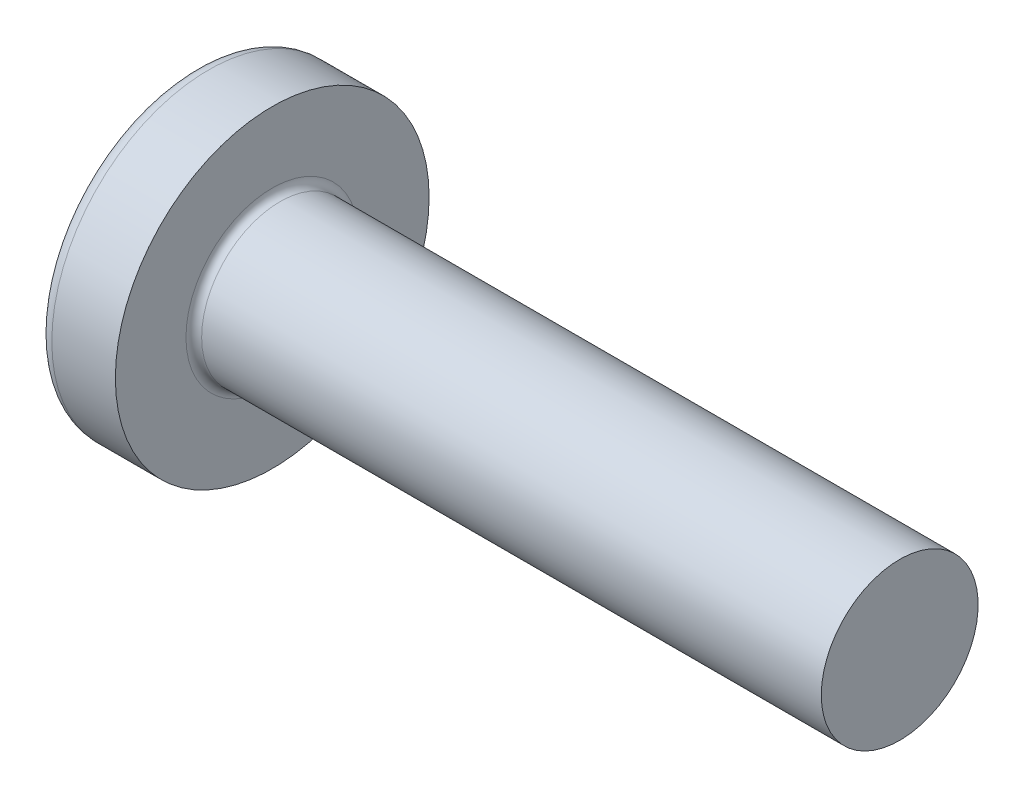
from build123d import *

# Parameters (mm, degrees)
FILLET1_R    = 0.1
RECPAT_COUNT = 2
RECPAT_ANGLE = 90


with BuildPart() as part:
    # BodySke → Base-Revolve (revolve)
    with BuildSketch(Plane.XY, mode=Mode.PRIVATE) as base_revolve_sk:
        with BuildLine():
            Line((1.6, 1), (1.6, 2))
            Line((1.6, 2), (0.790020747, 2))
            ThreePointArc((0.790020747, 2), (0.709789294, 1.981130115), (0.646379599, 1.928476821))
            ThreePointArc((0.646379599, 1.928476821), (0.165895084, 1.016959861), (0, 0))
            Line((0, 0), (9.6, 0))
            Line((9.6, 0), (9.6, 1))
            Line((9.6, 1), (1.6, 1))
        make_face()
    revolve(base_revolve_sk.sketch.rotate(Axis((0.790020747, 0, 0), (1, 0, 0)), 90), axis=Axis((0.790020747, 0, 0), (1, 0, 0)))

    # Fillet1
    fillet1_edges = [part.edges().sort_by_distance(p)[0] for p in [
        (1.6, 0, -1),
    ]]
    fillet(fillet1_edges, radius=FILLET1_R)

    # Sketch3 → Recess section 0
    with BuildSketch(Plane(origin=(0, 0, 0), x_dir=(0, 0, -1), z_dir=(1, 0, 0))):
        with BuildLine():
            Line((0.24, -1.05), (-0.24, -1.05))
            Line((-0.24, -1.05), (-0.24, 1.05))
            Line((-0.24, 1.05), (0.24, 1.05))
            Line((0.24, 1.05), (0.24, -1.05))
        make_face()
    # Sketch4 → Recess section 1
    with BuildSketch(Plane(origin=(1.42, 0, 0), x_dir=(0, 0, -1), z_dir=(1, 0, 0))):
        with BuildLine():
            Line((0.24, -0.342014235), (-0.24, -0.342014235))
            Line((-0.24, -0.342014235), (-0.24, 0.342014235))
            Line((-0.24, 0.342014235), (0.24, 0.342014235))
            Line((0.24, 0.342014235), (0.24, -0.342014235))
        make_face()
    recess = loft(mode=Mode.SUBTRACT)

    # RecPat: Recess ×2 about axis
    recpat_axis = Axis((0, 0, 0), (1, 0, 0))
    for i in range(1, RECPAT_COUNT):
        add(recess.rotate(recpat_axis, i * RECPAT_ANGLE / (RECPAT_COUNT - 1)), mode=Mode.SUBTRACT)

    # RecCorSke → RecessCore (revolve, cut)
    with BuildSketch(Plane.XY, mode=Mode.PRIVATE) as recesscore_sk:
        Polygon((0, 0), (0, 0.454796073), (1.42, 0.3555), (1.535508952, 0), align=None)
    revolve(recesscore_sk.sketch.rotate(Axis((-3.175, 0, 0), (1, 0, 0)), 13.894577695), axis=Axis((-3.175, 0, 0), (1, 0, 0)), mode=Mode.SUBTRACT)


solid = part.part
